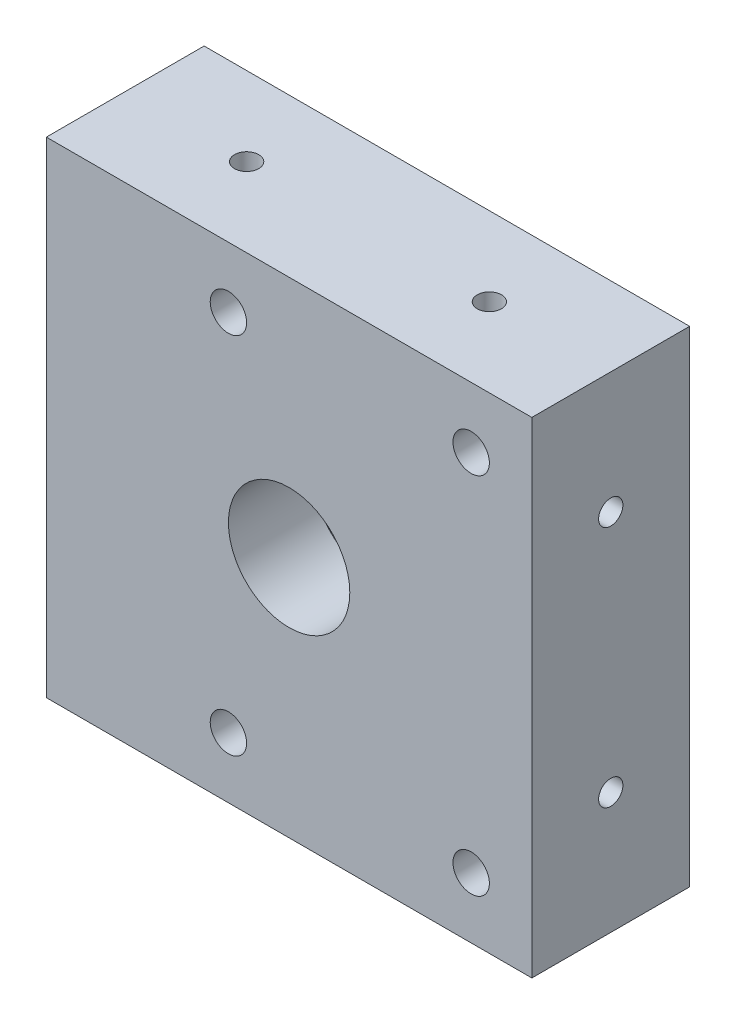
from build123d import *

# Parameters (mm, degrees)
SKETCH1_W            = 40
SKETCH1_H            = 40
SKETCH1_R            = 0.9
BOSS_EXTRUDE1_DEPTH  = 6
SKETCH11_W           = 40
SKETCH11_H           = 40
SKETCH11_R           = 5
BOSS_EXTRUDE6_DEPTH  = 7
SKETCH13_R           = 1.5
SKETCH13_R_2         = 1.395390764
CUT_EXTRUDE5_DEPTH   = 27
SKETCH13_3_R         = 3
SKETCH13_3_R_2       = 1.5
CUT_EXTRUDE6_DEPTH   = 3
SKETCH15_R           = 2.5
CUT_EXTRUDE9_DEPTH   = 5
CIRPATTERN4_COUNT    = 4
SKETCH16_R           = 3
BOSS_EXTRUDE7_DEPTH  = 13
SKETCH17_R           = 2.5
BOSS_EXTRUDE8_DEPTH  = 5
SKETCH18_R           = 2.5
BOSS_EXTRUDE9_DEPTH  = 5
SKETCH19_R           = 2.5
BOSS_EXTRUDE10_DEPTH = 5
SKETCH20_R           = 2.5
BOSS_EXTRUDE11_DEPTH = 5
SKETCH21_R           = 1.5
CUT_EXTRUDE10_DEPTH  = 25
SKETCH21_3_R         = 2.5
SKETCH21_3_R_2       = 1.5
CUT_EXTRUDE11_DEPTH  = 5
SKETCH22_R           = 1
CUT_EXTRUDE12_DEPTH  = 7
CIRPATTERN5_COUNT    = 4


with BuildPart() as part:
    # Sketch1 → Boss-Extrude1 (new body)
    with BuildSketch(Plane(origin=(0, 0, 0), x_dir=(0, 1, 0), z_dir=(0, 0, 1))):
        Rectangle(SKETCH1_W, SKETCH1_H)
        with Locations(Location((10.5, 0, 0), (0, 0, 270))):
            Circle(SKETCH1_R, mode=Mode.SUBTRACT)
        with Locations(Location((-10.5, 12.5, 0), (0, 0, 270))):
            Circle(SKETCH1_R, mode=Mode.SUBTRACT)
        with Locations(Location((-10.5, 0, 0), (0, 0, 270))):
            Circle(SKETCH1_R, mode=Mode.SUBTRACT)
        with Locations(Location((10.5, 12.5, 0), (0, 0, 270))):
            Circle(SKETCH1_R, mode=Mode.SUBTRACT)
        Polygon((-5, -13), (-8, -13), (-8, -5), (-5, -5), (-5, 5), (5, 5), (5, -5), (5, -13), align=None, mode=Mode.SUBTRACT)
    extrude(amount=BOSS_EXTRUDE1_DEPTH)

    # Sketch11 → Boss-Extrude6 (add)
    with BuildSketch(Plane.XY.offset(6)):
        Rectangle(SKETCH11_W, SKETCH11_H)
        with Locations(Location((0, 0, 0), (0, 0, 180))):
            Circle(SKETCH11_R, mode=Mode.SUBTRACT)
    extrude(amount=BOSS_EXTRUDE6_DEPTH)

    # Sketch13 → Cut-Extrude5 (cut)
    with BuildSketch(Plane(origin=(0, 0, 0), x_dir=(1, 0, 0), z_dir=(0, 0, -1))):
        with Locations(Location((-6.25, 13.75, 0), (0, 0, 180))):
            Circle(SKETCH13_R)
        with Locations(Location((6.25, 13.75, 0), (0, 0, 180))):
            Circle(SKETCH13_R)
        with Locations(Location((6.25, -13.75, 0), (0, 0, 180))):
            Circle(SKETCH13_R_2)
        with Locations(Location((-6.25, -13.75, 0), (0, 0, 180))):
            Circle(SKETCH13_R)
    extrude(amount=-CUT_EXTRUDE5_DEPTH, mode=Mode.SUBTRACT)

    # Sketch13<3> → Cut-Extrude6 (cut)
    # profile 1 of 4: a face of its own
    with BuildSketch(Plane(origin=(0, 0, 0), x_dir=(1, 0, 0), z_dir=(0, 0, -1))):
        with Locations(Location((-6.25, -13.75, 0), (0, 0, 180))):
            Circle(SKETCH13_3_R)
        with Locations(Location((-6.25, -13.75, 0), (0, 0, 180))):
            Circle(SKETCH13_3_R_2, mode=Mode.SUBTRACT)
    # profile 2 of 4: a face of its own
    with BuildSketch(Plane(origin=(0, 0, 0), x_dir=(1, 0, 0), z_dir=(0, 0, -1))):
        with Locations(Location((6.25, 13.75, 0), (0, 0, 180))):
            Circle(SKETCH13_3_R)
        with Locations(Location((6.25, 13.75, 0), (0, 0, 180))):
            Circle(SKETCH13_3_R_2, mode=Mode.SUBTRACT)
    # profile 3 of 4: a face of its own
    with BuildSketch(Plane(origin=(0, 0, 0), x_dir=(1, 0, 0), z_dir=(0, 0, -1))):
        with Locations(Location((-6.25, 13.75, 0), (0, 0, 180))):
            Circle(SKETCH13_3_R)
        with Locations(Location((-6.25, 13.75, 0), (0, 0, 180))):
            Circle(SKETCH13_3_R_2, mode=Mode.SUBTRACT)
    # profile 4 of 4: a face of its own
    with BuildSketch(Plane(origin=(0, 0, 0), x_dir=(1, 0, 0), z_dir=(0, 0, -1))):
        with Locations(Location((6.25, -13.75, 0), (0, 0, 180))):
            Circle(SKETCH13_3_R)
    extrude(amount=-CUT_EXTRUDE6_DEPTH, mode=Mode.SUBTRACT)

    # Sketch15 → Cut-Extrude9 (cut)
    with BuildSketch(Plane(origin=(0, 20, 0), x_dir=(-1, 0, 0), z_dir=(0, 1, 0))):
        with Locations(Location((-13.5, 6.5, 0), (0, 0, 90))):
            Circle(SKETCH15_R)
        with Locations(Location((13.5, 6.5, 0), (0, 0, 270))):
            Circle(SKETCH15_R)
    cut_extrude9 = extrude(amount=-CUT_EXTRUDE9_DEPTH, mode=Mode.SUBTRACT)

    # CirPattern4: Cut-Extrude9 ×4 about axis
    cirpattern4_axis = Axis((0, 0, 0), (0, 0, 1))
    for i in range(1, CIRPATTERN4_COUNT):
        add(cut_extrude9.rotate(cirpattern4_axis, i * 360 / CIRPATTERN4_COUNT), mode=Mode.SUBTRACT)

    # Sketch16 → Boss-Extrude7 (add)
    with BuildSketch(Plane(origin=(0, 0, 0), x_dir=(1, 0, 0), z_dir=(0, 0, -1))):
        with Locations((-6.25, 13.75)):
            Circle(SKETCH16_R)
        with Locations((6.25, 13.75)):
            Circle(SKETCH16_R)
        with Locations((-6.25, -13.75)):
            Circle(SKETCH16_R)
        with Locations((6.25, -13.75)):
            Circle(SKETCH16_R)
    extrude(amount=-BOSS_EXTRUDE7_DEPTH)

    # Sketch17 → Boss-Extrude8 (add)
    with BuildSketch(Plane(origin=(0, 20, 0), x_dir=(-1, 0, 0), z_dir=(0, 1, 0))):
        with Locations(Location((-13.5, 6.5, 0), (0, 0, 270))):
            Circle(SKETCH17_R)
        with Locations(Location((13.5, 6.5, 0), (0, 0, 306.869897646))):
            Circle(SKETCH17_R)
    extrude(amount=-BOSS_EXTRUDE8_DEPTH)

    # Sketch18 → Boss-Extrude9 (add)
    with BuildSketch(Plane(origin=(-20, 0, 0), x_dir=(0, -1, 0), z_dir=(-1, 0, 0))):
        with Locations(Location((-13.5, 6.5, 0), (0, 0, 233.130102354))):
            Circle(SKETCH18_R)
        with Locations(Location((13.5, 6.5, 0), (0, 0, 90))):
            Circle(SKETCH18_R)
    extrude(amount=-BOSS_EXTRUDE9_DEPTH)

    # Sketch19 → Boss-Extrude10 (add)
    with BuildSketch(Plane.XZ.offset(20)):
        with Locations((-13.5, 6.5)):
            Circle(SKETCH19_R)
        with Locations((13.5, 6.5)):
            Circle(SKETCH19_R)
    extrude(amount=-BOSS_EXTRUDE10_DEPTH)

    # Sketch20 → Boss-Extrude11 (add)
    with BuildSketch(Plane.YZ.offset(20)):
        with Locations((-13.5, 6.5)):
            Circle(SKETCH20_R)
        with Locations((13.5, 6.5)):
            Circle(SKETCH20_R)
    extrude(amount=-BOSS_EXTRUDE11_DEPTH)

    # Sketch21 → Cut-Extrude10 (cut)
    with BuildSketch(Plane(origin=(0, 0, 0), x_dir=(1, 0, 0), z_dir=(0, 0, -1))):
        with Locations(Location((-5, 15, 0), (0, 0, 180))):
            Circle(SKETCH21_R)
        with Locations(Location((15, 15, 0), (0, 0, 180))):
            Circle(SKETCH21_R)
        with Locations(Location((15, -15, 0), (0, 0, 180))):
            Circle(SKETCH21_R)
        with Locations(Location((-5, -15, 0), (0, 0, 180))):
            Circle(SKETCH21_R)
    extrude(amount=-CUT_EXTRUDE10_DEPTH, mode=Mode.SUBTRACT)

    # Sketch21<3> → Cut-Extrude11 (cut)
    # profile 1 of 4: a face of its own
    with BuildSketch(Plane(origin=(0, 0, 0), x_dir=(1, 0, 0), z_dir=(0, 0, -1))):
        with Locations(Location((-5, 15, 0), (0, 0, 180))):
            Circle(SKETCH21_3_R)
        with Locations(Location((-5, 15, 0), (0, 0, 180))):
            Circle(SKETCH21_3_R_2, mode=Mode.SUBTRACT)
    # profile 2 of 4: a face of its own
    with BuildSketch(Plane(origin=(0, 0, 0), x_dir=(1, 0, 0), z_dir=(0, 0, -1))):
        with Locations(Location((15, 15, 0), (0, 0, 180))):
            Circle(SKETCH21_3_R)
        with Locations(Location((15, 15, 0), (0, 0, 180))):
            Circle(SKETCH21_3_R_2, mode=Mode.SUBTRACT)
    # profile 3 of 4: a face of its own
    with BuildSketch(Plane(origin=(0, 0, 0), x_dir=(1, 0, 0), z_dir=(0, 0, -1))):
        with Locations(Location((15, -15, 0), (0, 0, 180))):
            Circle(SKETCH21_3_R)
        with Locations(Location((15, -15, 0), (0, 0, 180))):
            Circle(SKETCH21_3_R_2, mode=Mode.SUBTRACT)
    # profile 4 of 4: a face of its own
    with BuildSketch(Plane(origin=(0, 0, 0), x_dir=(1, 0, 0), z_dir=(0, 0, -1))):
        with Locations(Location((-5, -15, 0), (0, 0, 180))):
            Circle(SKETCH21_3_R)
        with Locations(Location((-5, -15, 0), (0, 0, 180))):
            Circle(SKETCH21_3_R_2, mode=Mode.SUBTRACT)
    extrude(amount=-CUT_EXTRUDE11_DEPTH, mode=Mode.SUBTRACT)

    # Sketch22 → Cut-Extrude12 (cut)
    with BuildSketch(Plane(origin=(0, 20, 0), x_dir=(-1, 0, 0), z_dir=(0, 1, 0))):
        with Locations(Location((-10, 6.5, 0), (0, 0, 90))):
            Circle(SKETCH22_R)
        with Locations(Location((10, 6.5, 0), (0, 0, 270))):
            Circle(SKETCH22_R)
    cut_extrude12 = extrude(amount=-CUT_EXTRUDE12_DEPTH, mode=Mode.SUBTRACT)

    # CirPattern5: Cut-Extrude12 ×4 about axis
    cirpattern5_axis = Axis((0, 0, 0), (0, 0, 1))
    for i in range(1, CIRPATTERN5_COUNT):
        add(cut_extrude12.rotate(cirpattern5_axis, i * 360 / CIRPATTERN5_COUNT), mode=Mode.SUBTRACT)


solid = part.part
